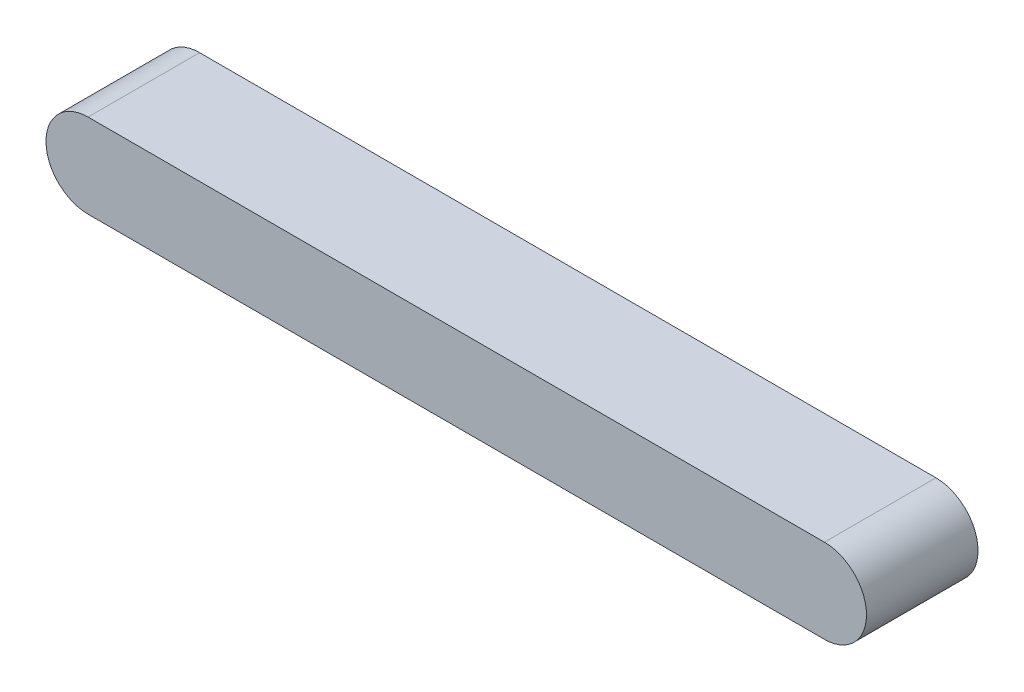
from build123d import *

# Parameters (mm, degrees)
SALIENTE_EXTRUIR1_DEPTH = 5.3


with BuildPart() as part:
    # Croquis1 → Saliente-Extruir1 (new body)
    with BuildSketch(Plane.XY):
        with BuildLine():
            Line((0, 2), (35, 2))
            ThreePointArc((35, 2), (37, 0), (35, -2))
            Line((35, -2), (0, -2))
            ThreePointArc((0, -2), (-2, 0), (0, 2))
        make_face()
    extrude(amount=SALIENTE_EXTRUIR1_DEPTH)


solid = part.part
